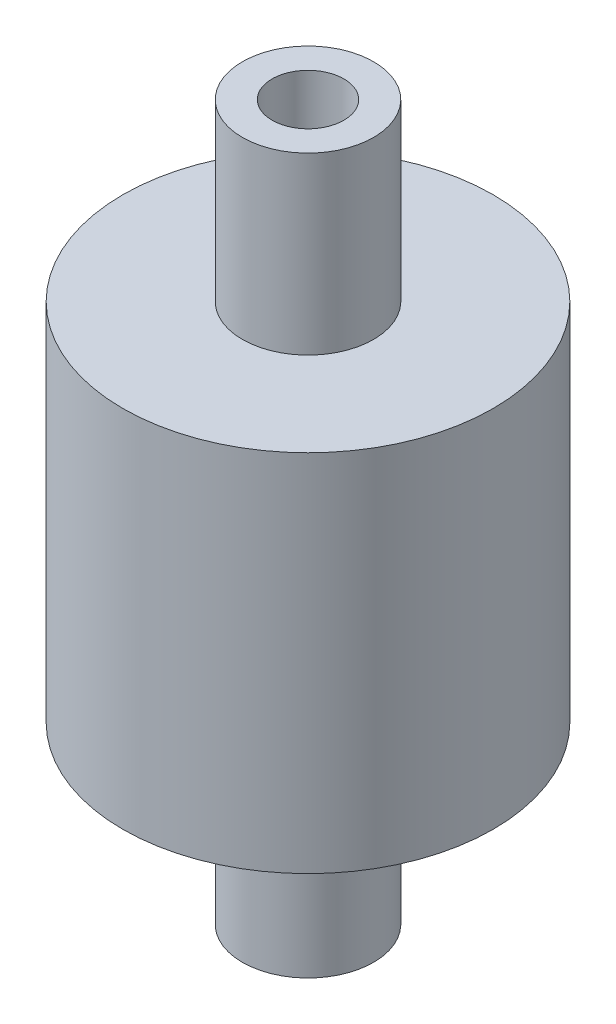
from build123d import *

# Parameters (mm, degrees)
CROQUIS1_R                 = 12.7
SALIENTE_EXTRUIR1_DEPTH    = 12.5
CROQUIS2_R                 = 4.5
SALIENTE_EXTRUIR2_DEPTH    = 24.5
CORTAR_EXTRUIR1_DEPTH      = 31.378117124
CORTAR_EXTRUIR1_DEPTH_BACK = 31.378117124
CROQUIS3_R                 = 2.460715963


with BuildPart() as part:
    # Croquis1 → Saliente-Extruir1 (new, symmetric)
    with BuildSketch(Plane(origin=(0, 0, 0), x_dir=(1, 0, 0), z_dir=(0, 1, 0))):
        with Locations(Location((0, 0, 0), (0, 0, 270))):
            Circle(CROQUIS1_R)
    extrude(amount=SALIENTE_EXTRUIR1_DEPTH, both=True)

    # Croquis2 → Saliente-Extruir2 (add, symmetric)
    with BuildSketch(Plane(origin=(0, 0, 0), x_dir=(1, 0, 0), z_dir=(0, 1, 0))):
        with Locations(Location((0, 0, 0), (0, 0, 270))):
            Circle(CROQUIS2_R)
    extrude(amount=SALIENTE_EXTRUIR2_DEPTH, both=True)

    # Croquis3 → Cortar-Extruir1 (cut, two sides: drawn at the far end of the back side and taken through both)
    with BuildSketch(Plane(origin=(0, 0, 0), x_dir=(1, 0, 0), z_dir=(0, 1, 0)).offset(-CORTAR_EXTRUIR1_DEPTH_BACK)):
        with Locations(Location((0, 0, 0), (0, 0, 270))):
            Circle(CROQUIS3_R)
    extrude(amount=CORTAR_EXTRUIR1_DEPTH + CORTAR_EXTRUIR1_DEPTH_BACK, mode=Mode.SUBTRACT)


solid = part.part
